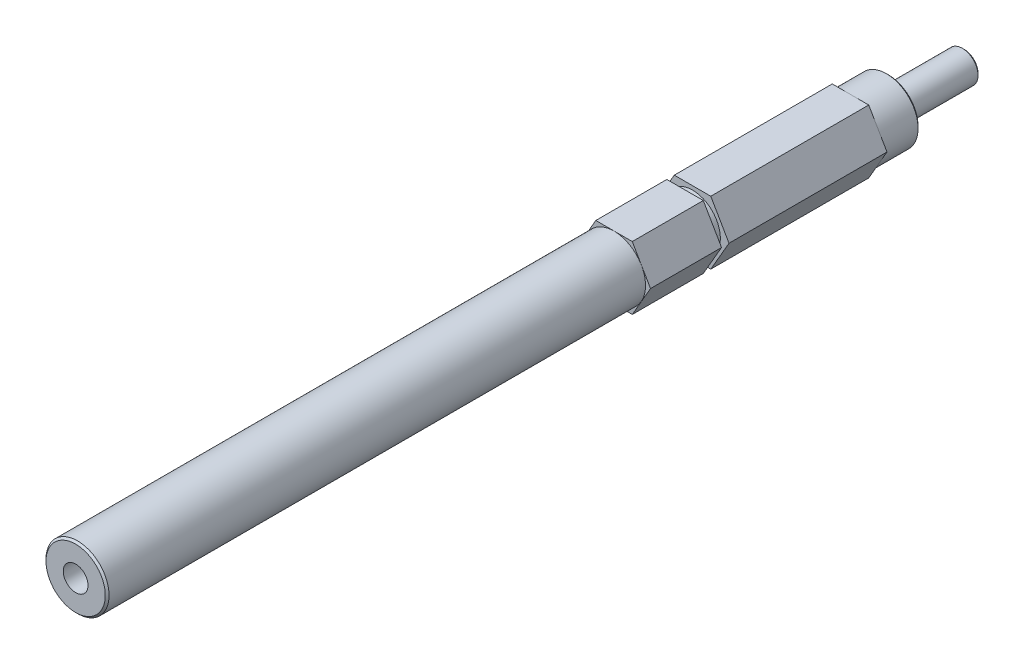
from build123d import *

# Parameters (mm, degrees)
BOSS_EXTRUDE1_DEPTH = 31.75
SKETCH2_R           = 5.588
BOSS_EXTRUDE2_DEPTH = 1.4986
BOSS_EXTRUDE3_DEPTH = 14.2748
SKETCH4_R           = 6.3373
BOSS_EXTRUDE4_DEPTH = 108.204
HOLE1_D             = 4.97586
HOLE1_DEPTH         = 15.875
CHAMFER1_SIZE       = 0.381
CHAMFER2_SIZE       = 0.381
CHAMFER3_SIZE       = 0.381
CUT_EXTRUDE2_DEPTH  = 2.54


with BuildPart() as part:
    # Sketch1 → Boss-Extrude1 (new body)
    with BuildSketch(Plane(origin=(0, 0, 0), x_dir=(-1, 0, 0), z_dir=(0, 0, -1))):
        Polygon((-16.385658369, 0), (-12.71948416, -6.35), (-5.387135741, -6.35), (-1.720961532, 0), (-5.387135741, 6.35), (-12.71948416, 6.35), align=None)
    extrude(amount=-BOSS_EXTRUDE1_DEPTH)

    # Sketch2 → Boss-Extrude2 (add)
    with BuildSketch(Plane.XY.offset(31.75)):
        with Locations(Location((9.053309951, 0, 0), (0, 0, 180))):
            Circle(SKETCH2_R)
    extrude(amount=BOSS_EXTRUDE2_DEPTH)

    # Sketch3 → Boss-Extrude3 (add)
    with BuildSketch(Plane(origin=(0, 0, 33.2486), x_dir=(-1, 0, 0), z_dir=(0, 0, -1))):
        Polygon((-12.71948416, -6.35), (-5.387135741, -6.35), (-1.720961532, 0), (-5.387135741, 6.35), (-12.71948416, 6.35), (-16.385658369, 0), align=None)
    extrude(amount=-BOSS_EXTRUDE3_DEPTH)

    # Sketch4 → Boss-Extrude4 (add)
    with BuildSketch(Plane.XY.offset(47.5234)):
        with Locations(Location((9.053309951, 0, 0), (0, 0, 180))):
            Circle(SKETCH4_R)
    extrude(amount=BOSS_EXTRUDE4_DEPTH)

    # Sketch6 → Revolve1 (revolve)
    with BuildSketch(Plane.XZ, mode=Mode.PRIVATE) as revolve1_sk:
        Polygon((15.396959951, 0), (9.053309951, 0), (9.053309951, -22.86), (12.202909951, -22.86), (12.202909951, -7.62), (15.396959951, -7.62), align=None)
    revolve(revolve1_sk.sketch.rotate(Axis((9.053309951, 0, 0), (0, 0, -1)), 180), axis=Axis((9.053309951, 0, 0), (0, 0, -1)))

    # Hole1
    with Locations(Plane.XY.offset(155.7274)):
        with Locations((9.053309951, 0)):
            Hole(HOLE1_D / 2, depth=HOLE1_DEPTH)

    # Chamfer1
    chamfer1_edges = [part.edges().sort_by_distance(p)[0] for p in [
        (15.396959951, 0, -7.62),
    ]]
    chamfer(chamfer1_edges, length=CHAMFER1_SIZE)

    # Chamfer2
    chamfer2_edges = [part.edges().sort_by_distance(p)[0] for p in [
        (15.390609951, 0, 155.7274),
    ]]
    chamfer(chamfer2_edges, length=CHAMFER2_SIZE)

    # Chamfer3
    chamfer3_edges = [part.edges().sort_by_distance(p)[0] for p in [
        (12.202909951, 0, -22.86),
    ]]
    chamfer(chamfer3_edges, length=CHAMFER3_SIZE)

    # Sketch5 → Cut-Extrude2 (cut)
    with BuildSketch(Plane(origin=(0, -4.699, 0), x_dir=(-1, 0, 0), z_dir=(0, 1, 0))):
        with BuildLine():
            Line((-7.427709951, 59.2074), (-7.427709951, 153.1874))
            ThreePointArc((-7.427709951, 153.1874), (-9.053309951, 154.813), (-10.678909951, 153.1874))
            Line((-10.678909951, 153.1874), (-10.678909951, 59.2074))
            ThreePointArc((-10.678909951, 59.2074), (-9.053309951, 57.5818), (-7.427709951, 59.2074))
        make_face()
    extrude(amount=-CUT_EXTRUDE2_DEPTH, mode=Mode.SUBTRACT)


solid = part.part
